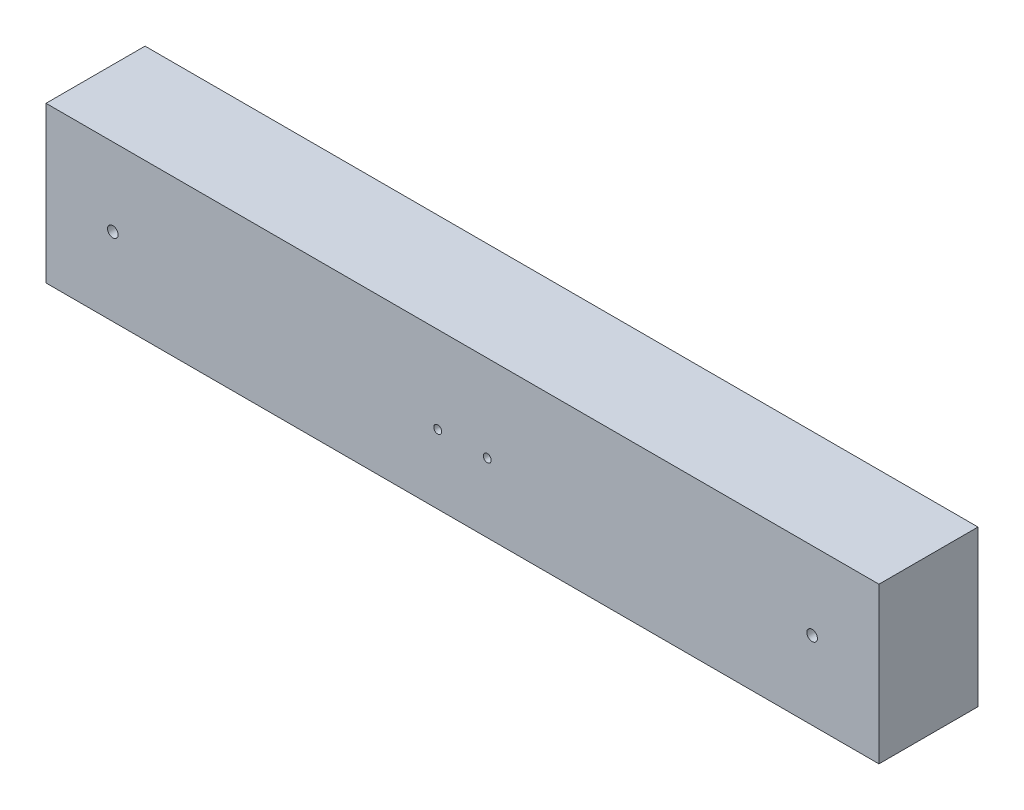
from build123d import *

# Parameters (mm, degrees)
SKETCH1_W           = 747.7252
SKETCH1_H           = 139.7
BOSS_EXTRUDE1_DEPTH = 88.9
SKETCH2_R           = 4.7625
CUT_EXTRUDE1_DEPTH  = 391.583507305
SKETCH3_R           = 3.571875
CUT_EXTRUDE2_DEPTH  = 391.583507305


with BuildPart() as part:
    # Sketch1 → Boss-Extrude1 (new body)
    with BuildSketch(Plane.XY):
        Rectangle(SKETCH1_W, SKETCH1_H)
    extrude(amount=BOSS_EXTRUDE1_DEPTH)

    # Sketch2 → Cut-Extrude1 (cut, through all)
    with BuildSketch(Plane.XY.offset(88.9)):
        with Locations((-313.8626, 0)):
            Circle(SKETCH2_R)
        with Locations((313.8626, 0)):
            Circle(SKETCH2_R)
    extrude(amount=-CUT_EXTRUDE1_DEPTH, mode=Mode.SUBTRACT)

    # Sketch3 → Cut-Extrude2 (cut, through all)
    with BuildSketch(Plane.XY.offset(88.9)):
        with Locations((-22.225, -7.8867)):
            Circle(SKETCH3_R)
        with Locations((22.225, -7.8867)):
            Circle(SKETCH3_R)
    extrude(amount=-CUT_EXTRUDE2_DEPTH, mode=Mode.SUBTRACT)


solid = part.part
